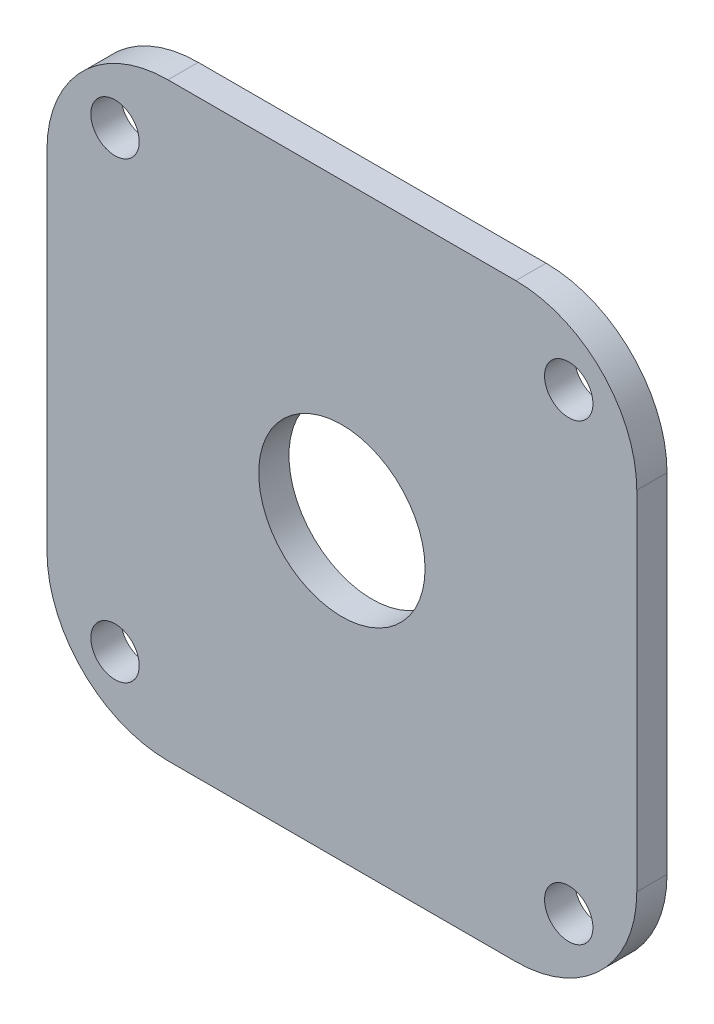
from build123d import *

# Parameters (mm, degrees)
SKETCH_1_R      = 1.6
SKETCH_1_R_2    = 5.5
EXTRUDE_2_DEPTH = 2
FILLET_6_R      = 8
FILLET_7_R      = 8
FILLET_8_R      = 8
FILLET_9_R      = 8


with BuildPart() as part:
    # 草图1 → 凸台-拉伸2 (new body)
    # profile 1 of 2: a face of its own
    with BuildSketch(Plane.XY):
        with BuildLine():
            Line((-16.6, 15), (-19.5, 15))
            Line((-19.5, 15), (-19.5, -19.5))
            Line((-19.5, -19.5), (19.5, -19.5))
            Line((19.5, -19.5), (19.5, 19.5))
            Line((19.5, 19.5), (-15, 19.5))
            Line((-15, 19.5), (-15, 16.6))
            ThreePointArc((-15, 16.6), (-13.86862915, 16.13137085), (-13.4, 15))
            ThreePointArc((-13.4, 15), (-15, 13.4), (-16.6, 15))
        make_face()
        with Locations((-15, -15)):
            Circle(SKETCH_1_R, mode=Mode.SUBTRACT)
        with Locations((15, -15)):
            Circle(SKETCH_1_R, mode=Mode.SUBTRACT)
        Circle(SKETCH_1_R_2, mode=Mode.SUBTRACT)
        with Locations((15, 15)):
            Circle(SKETCH_1_R, mode=Mode.SUBTRACT)
    # profile 2 of 2: a face of its own
    with BuildSketch(Plane.XY):
        with BuildLine():
            Line((-19.5, 19.5), (-19.5, 15))
            Line((-19.5, 15), (-16.6, 15))
            ThreePointArc((-16.6, 15), (-16.13137085, 16.13137085), (-15, 16.6))
            Line((-15, 16.6), (-15, 19.5))
            Line((-15, 19.5), (-19.5, 19.5))
        make_face()
    extrude(amount=EXTRUDE_2_DEPTH)

    # 圆角6
    fillet_6_edges = [part.edges().sort_by_distance(p)[0] for p in [
        (-19.5, 19.5, 1),
    ]]
    fillet(fillet_6_edges, radius=FILLET_6_R)

    # 圆角7
    fillet_7_edges = [part.edges().sort_by_distance(p)[0] for p in [
        (19.5, 19.5, 1),
    ]]
    fillet(fillet_7_edges, radius=FILLET_7_R)

    # 圆角8
    fillet_8_edges = [part.edges().sort_by_distance(p)[0] for p in [
        (-19.5, -19.5, 1),
    ]]
    fillet(fillet_8_edges, radius=FILLET_8_R)

    # 圆角9
    fillet_9_edges = [part.edges().sort_by_distance(p)[0] for p in [
        (19.5, -19.5, 1),
    ]]
    fillet(fillet_9_edges, radius=FILLET_9_R)


solid = part.part
